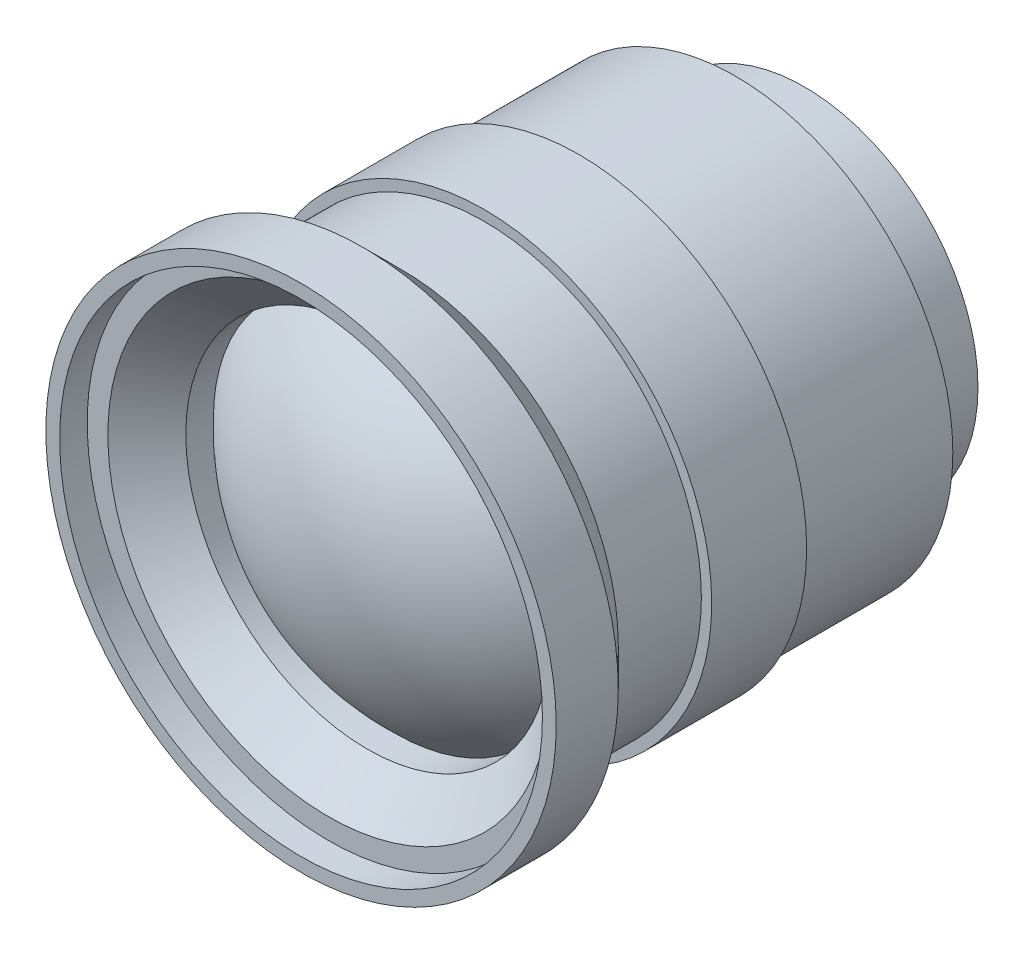
from build123d import *


with BuildPart() as part:
    # Sketch1 → Revolve1 (revolve)
    with BuildSketch(Plane(origin=(0, 0, 0), x_dir=(0, 0, -1), z_dir=(1, 0, 0)), mode=Mode.PRIVATE) as revolve1_sk:
        with BuildLine():
            Line((0, 0), (0, 12.575))
            Line((0, 12.575), (-5, 12.575))
            Line((-5, 12.575), (-5, 15.75))
            Line((-5, 15.75), (-16.345423433, 15.75))
            Line((-16.345423433, 15.75), (-16.345423433, 16.5))
            Line((-16.345423433, 16.5), (-23.228752503, 16.5))
            Line((-23.228752503, 16.5), (-23.228752503, 15.75))
            Line((-23.228752503, 15.75), (-29.251665438, 15.75))
            Line((-29.251665438, 15.75), (-32.001665438, 18.5))
            Line((-32.001665438, 18.5), (-36.5, 18.5))
            Line((-36.5, 18.5), (-36.5, 17.5))
            Line((-36.5, 17.5), (-34.5, 17.5))
            Line((-34.5, 17.5), (-34.5, 16))
            Line((-34.5, 16), (-31.676037941, 13.176037941))
            Line((-31.676037941, 13.176037941), (-29.676037941, 13.176037941))
            ThreePointArc((-29.676037941, 13.176037941), (-33.951349088, 7.19510787), (-35.461393008, 0))
            Line((-35.461393008, 0), (0, 0))
        make_face()
    revolve(revolve1_sk.sketch.rotate(Axis((0, 0, 35.461393008), (0, 0, -1)), 90), axis=Axis((0, 0, 35.461393008), (0, 0, -1)))


solid = part.part
